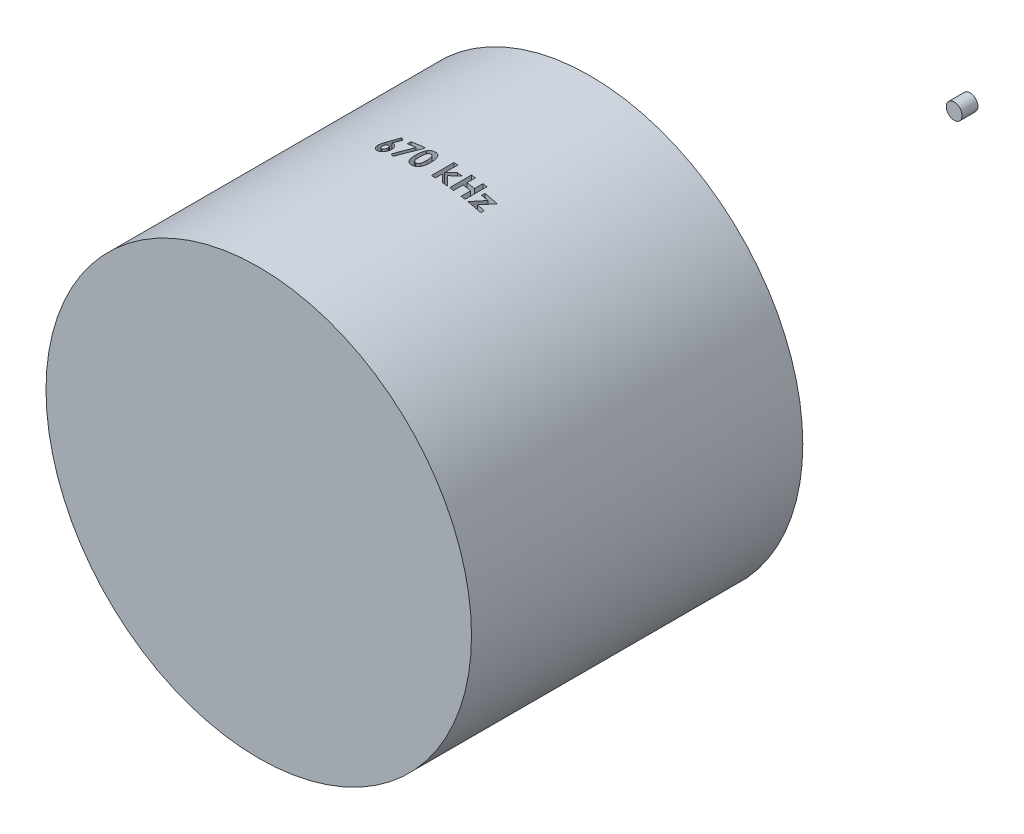
from build123d import *

# Parameters (mm, degrees)
SKETCH2_W          = 52.999999918
SKETCH2_H          = 34.036
SKETCH2_W_2        = 2.54
SKETCH2_H_2        = 1.27
CUT_EXTRUDE1_START = 50.8
CUT_EXTRUDE1_DEPTH = 22.86


with BuildPart() as part:
    # Sketch2 → Revolve1 (revolve)
    with BuildSketch(Plane(origin=(0, 0, 0), x_dir=(0, 0, -1), z_dir=(1, 0, 0)), mode=Mode.PRIVATE) as revolve1_sk:
        with Locations((26.499999959, 17.018)):
            Rectangle(SKETCH2_W, SKETCH2_H)
        with Locations((112.525999992, 0.635)):
            Rectangle(SKETCH2_W_2, SKETCH2_H_2)
    revolve(revolve1_sk.sketch.rotate(Axis((0, 0, 0), (0, 0, -1)), 90), axis=Axis((0, 0, 0), (0, 0, -1)))

    # Sketch3 → Cut-Extrude1 (cut)
    # profile 1 of 6: a face of its own
    with BuildSketch(Plane(origin=(0, 0, 0), x_dir=(1, 0, 0), z_dir=(0, 1, 0)).offset(CUT_EXTRUDE1_START)):
        with BuildLine():
            Line((-7.23838141, 30.089743549), (-6.682391827, 29.807892587))
            Line((-6.682391827, 29.807892587), (-7.292367788, 28.608974318))
            add(Edge.make_bspline(
                [(-7.292367788, 28.608974318), (-7.256330981, 28.608041307), (-7.185350579, 28.606203588), (-7.08091732, 28.591350841), (-6.98107718, 28.565674002), (-6.884823476, 28.531639422), (-6.793332818, 28.485930642), (-6.705131698, 28.431557664), (-6.622501924, 28.365243969), (-6.543548865, 28.291771913), (-6.471757254, 28.210375434), (-6.409393548, 28.122912332), (-6.355044679, 28.031510595), (-6.312796055, 27.934125343), (-6.278716909, 27.832370849), (-6.254127305, 27.725840355), (-6.240098248, 27.614225374), (-6.238164108, 27.538400261), (-6.237179487, 27.499799638)],
                knots=[0, 0, 0, 0, 1.013260694, 1.995783107, 2.958651975, 3.908806537, 4.861209129, 5.829647963, 6.817170299, 7.835534541, 8.860094905, 9.863329007, 10.853101798, 11.844815043, 12.84250023, 13.867713965, 14.914507806, 16, 16, 16, 16], degree=3))
            add(Edge.make_bspline(
                [(-6.237179487, 27.499799638), (-6.238102158, 27.46259098), (-6.239925884, 27.389045418), (-6.255001389, 27.281025691), (-6.279364196, 27.177387081), (-6.314183541, 27.078336566), (-6.358441744, 26.983389984), (-6.412566528, 26.892603051), (-6.477006754, 26.806654188), (-6.550097463, 26.726000086), (-6.629998218, 26.652483276), (-6.714217965, 26.587137256), (-6.803470373, 26.533158965), (-6.896068466, 26.487573032), (-6.993717032, 26.453556051), (-7.094954755, 26.427879124), (-7.20054935, 26.413062422), (-7.272224256, 26.411199205), (-7.30849359, 26.410256369)],
                knots=[0, 0, 0, 0, 1.049934834, 2.075270938, 3.072134561, 4.05064612, 5.033440221, 6.024524368, 7.028587226, 8.060776465, 9.092543989, 10.090062252, 11.064205434, 12.031961459, 12.998029633, 13.977230324, 14.976426867, 16, 16, 16, 16], degree=3))
            add(Edge.make_bspline(
                [(-7.30849359, 26.410256369), (-7.346420291, 26.411030104), (-7.420998017, 26.412551549), (-7.530123894, 26.429587726), (-7.634785003, 26.455233315), (-7.73439313, 26.491850859), (-7.829567709, 26.538476355), (-7.919188231, 26.596170717), (-8.004009624, 26.66429773), (-8.083127569, 26.741324644), (-8.154406941, 26.82569709), (-8.217982184, 26.913297656), (-8.271766921, 27.004263807), (-8.315304412, 27.098498281), (-8.349273373, 27.195700798), (-8.372908841, 27.296055839), (-8.388309529, 27.399297213), (-8.390114909, 27.469362652), (-8.391025641, 27.504707491)],
                knots=[0, 0, 0, 0, 1.063775006, 2.091769615, 3.092589432, 4.084662827, 5.064601646, 6.061867366, 7.070035304, 8.113879863, 9.156342271, 10.166834137, 11.149076039, 12.117706134, 13.076241869, 14.034148791, 15.008317125, 16, 16, 16, 16], degree=3))
            add(Edge.make_bspline(
                [(-8.391025641, 27.504707491), (-8.390544428, 27.532077935), (-8.389579323, 27.586971177), (-8.3798806, 27.669170824), (-8.365135132, 27.751586237), (-8.348043205, 27.821130973), (-8.330443666, 27.879938325), (-8.312729594, 27.929705398), (-8.290776905, 27.984935966), (-8.265681729, 28.045771068), (-8.236654916, 28.112137517), (-8.203848094, 28.183854417), (-8.167179592, 28.261464861), (-8.141029899, 28.314771219), (-8.127403846, 28.342548036)],
                knots=[0, 0, 0, 0, 1.110454016, 2.227089276, 3.35462975, 4.507227546, 5.131400587, 5.845402449, 6.650387134, 7.543487832, 8.516250726, 9.590168902, 10.744287919, 12, 12, 12, 12], degree=3))
            Line((-8.127403846, 28.342548036), (-7.23838141, 30.089743549))
        make_face()
        with BuildLine():
            add(Edge.make_bspline(
                [(-7.322516026, 28.025640985), (-7.35265922, 28.02425838), (-7.411645494, 28.021552804), (-7.495515154, 27.993218698), (-7.571985255, 27.948769537), (-7.638270484, 27.886865484), (-7.69371198, 27.81288771), (-7.734452336, 27.728506177), (-7.758959924, 27.634846934), (-7.761506106, 27.569361953), (-7.762820513, 27.53555685)],
                knots=[0, 0, 0, 0, 0.981744412, 1.921144944, 2.858899012, 3.85339082, 4.86292663, 5.863643845, 6.897155691, 8, 8, 8, 8], degree=3))
            add(Edge.make_bspline(
                [(-7.762820513, 27.53555685), (-7.761264214, 27.50174049), (-7.758237108, 27.43596541), (-7.732808002, 27.341414364), (-7.691172666, 27.255116624), (-7.632781761, 27.180158484), (-7.564231679, 27.117937424), (-7.488217768, 27.071921975), (-7.406007968, 27.043653175), (-7.349141442, 27.040204006), (-7.32041266, 27.038461497)],
                knots=[0, 0, 0, 0, 1.098279937, 2.136227893, 3.159405121, 4.194678092, 5.206500211, 6.154139736, 7.067477469, 8, 8, 8, 8], degree=3))
            add(Edge.make_bspline(
                [(-7.32041266, 27.038461497), (-7.290071819, 27.040235041), (-7.230568161, 27.043713269), (-7.144730231, 27.07079257), (-7.066316767, 27.116037109), (-6.996984097, 27.178058963), (-6.937428652, 27.25216173), (-6.896222299, 27.338966371), (-6.869617594, 27.434199853), (-6.866827244, 27.501013683), (-6.865384615, 27.53555685)],
                knots=[0, 0, 0, 0, 0.96921794, 1.900804717, 2.848419905, 3.844199796, 4.861108892, 5.867439427, 6.897452859, 8, 8, 8, 8], degree=3))
            add(Edge.make_bspline(
                [(-6.865384615, 27.53555685), (-6.867028033, 27.569342214), (-6.870210702, 27.634771517), (-6.894116323, 27.728869532), (-6.936798194, 27.812925827), (-6.993494098, 27.887170853), (-7.062060514, 27.949047302), (-7.141591104, 27.993569238), (-7.22929207, 28.021502605), (-7.290988303, 28.024241412), (-7.322516026, 28.025640985)],
                knots=[0, 0, 0, 0, 1.083229974, 2.097801324, 3.086792542, 4.086858909, 5.079819718, 6.026392613, 6.991456328, 8, 8, 8, 8], degree=3))
        make_face(mode=Mode.SUBTRACT)
    # profile 2 of 6: a face of its own
    with BuildSketch(Plane(origin=(0, 0, 0), x_dir=(1, 0, 0), z_dir=(0, 1, 0)).offset(CUT_EXTRUDE1_START)):
        Polygon((-5.653846154, 29.999999959), (-3.41025641, 29.999999959), (-3.41025641, 29.673978324), (-4.954126603, 26.410256369), (-5.510817308, 26.690705087), (-4.220753205, 29.416666626), (-5.653846154, 29.416666626), align=None)
    # profile 3 of 6: a face of its own
    with BuildSketch(Plane(origin=(0, 0, 0), x_dir=(1, 0, 0), z_dir=(0, 1, 0)).offset(CUT_EXTRUDE1_START)):
        with BuildLine():
            add(Edge.make_bspline(
                [(-1.917568109, 30.089743549), (-1.887160373, 30.089292137), (-1.827370641, 30.088404542), (-1.739311619, 30.07879116), (-1.654486435, 30.064268022), (-1.572563241, 30.044013308), (-1.494131729, 30.017206916), (-1.418621058, 29.985120124), (-1.346930023, 29.946069915), (-1.278144335, 29.901960697), (-1.21229049, 29.85202281), (-1.15095124, 29.795091039), (-1.093006398, 29.732475389), (-1.039710259, 29.663229222), (-0.989882561, 29.587982406), (-0.943687031, 29.506723009), (-0.901477308, 29.41905332), (-0.86278032, 29.324815133), (-0.828177351, 29.222595858), (-0.799031313, 29.111222996), (-0.774033709, 28.990671112), (-0.752933967, 28.860640135), (-0.736985972, 28.720957223), (-0.726236703, 28.571715173), (-0.718860045, 28.413201703), (-0.718258014, 28.304462765), (-0.717948718, 28.248597715)],
                knots=[0, 0, 0, 0, 0.879237366, 1.728815576, 2.559023295, 3.367336655, 4.166867292, 4.954216142, 5.737608147, 6.525189134, 7.316157332, 8.124696809, 8.942788509, 9.781158001, 10.649253743, 11.551476218, 12.482711956, 13.461909668, 14.496590415, 15.601789533, 16.789733467, 18.056700938, 19.410929216, 20.8549011, 22.384193279, 24, 24, 24, 24], degree=3))
            add(Edge.make_bspline(
                [(-0.717948718, 28.248597715), (-0.718282983, 28.192033731), (-0.718932455, 28.082130924), (-0.725930053, 27.922167609), (-0.737980247, 27.771841973), (-0.753511408, 27.631169567), (-0.774784849, 27.500224678), (-0.799699006, 27.378668248), (-0.829305105, 27.266544337), (-0.865047885, 27.164105584), (-0.903510639, 27.069701894), (-0.945835825, 26.98220314), (-0.991285719, 26.901372328), (-1.038817839, 26.825990014), (-1.091038071, 26.75827843), (-1.145404707, 26.69593503), (-1.20428497, 26.641334552), (-1.265199772, 26.591663134), (-1.330380668, 26.548737061), (-1.399155466, 26.511194625), (-1.4727503, 26.48074325), (-1.549823662, 26.454258271), (-1.631689283, 26.435244914), (-1.717046329, 26.420158439), (-1.806858464, 26.411820728), (-1.868006184, 26.41078638), (-1.899338942, 26.410256369)],
                knots=[0, 0, 0, 0, 1.643780988, 3.193836972, 4.651895693, 6.025988579, 7.305620092, 8.505800249, 9.631074763, 10.672816429, 11.65661981, 12.592235626, 13.49536222, 14.350718032, 15.179365177, 15.97804903, 16.751647189, 17.51006938, 18.259804725, 19.016521909, 19.783502495, 20.571750527, 21.382245291, 22.22305063, 23.089471752, 24, 24, 24, 24], degree=3))
            add(Edge.make_bspline(
                [(-1.899338942, 26.410256369), (-1.930670855, 26.410796604), (-1.992049612, 26.411854916), (-2.082104608, 26.420096445), (-2.167914004, 26.435306029), (-2.250427314, 26.454404241), (-2.329070257, 26.480684649), (-2.404219925, 26.512047107), (-2.475298482, 26.549355297), (-2.542502733, 26.592381384), (-2.605603224, 26.641720463), (-2.665580535, 26.696844797), (-2.722301994, 26.75761466), (-2.774904727, 26.824710724), (-2.824250214, 26.897237398), (-2.869823859, 26.9760229), (-2.911598275, 27.06095252), (-2.950880172, 27.152144643), (-2.985011168, 27.251562529), (-3.01538617, 27.360093968), (-3.040268572, 27.478643659), (-3.060280665, 27.607173516), (-3.076258309, 27.745411244), (-3.088143839, 27.893423565), (-3.095180306, 28.051279421), (-3.095822966, 28.159781614), (-3.096153846, 28.215644991)],
                knots=[0, 0, 0, 0, 0.917216111, 1.796812873, 2.643793957, 3.46689424, 4.273913431, 5.068098542, 5.848489301, 6.620921603, 7.401012384, 8.190319798, 9.003608147, 9.831726257, 10.68377682, 11.569763213, 12.493818149, 13.453288342, 14.474581811, 15.568529029, 16.750744269, 18.018426408, 19.375425659, 20.823733699, 22.36466933, 24, 24, 24, 24], degree=3))
            add(Edge.make_bspline(
                [(-3.096153846, 28.215644991), (-3.095554488, 28.293262756), (-3.09439802, 28.443027234), (-3.079742399, 28.659393361), (-3.058231666, 28.859386365), (-3.026637494, 29.042671708), (-2.987571737, 29.209928224), (-2.937546001, 29.360054115), (-2.880595339, 29.495126711), (-2.83206606, 29.57514453), (-2.80869391, 29.61368185)],
                knots=[0, 0, 0, 0, 1.288568992, 2.486310467, 3.599230591, 4.627010532, 5.572937695, 6.447898582, 7.252493626, 8, 8, 8, 8], degree=3))
            add(Edge.make_bspline(
                [(-2.80869391, 29.61368185), (-2.781517888, 29.651540901), (-2.72838341, 29.725562807), (-2.635476291, 29.822739733), (-2.535659687, 29.905850198), (-2.426883423, 29.973013339), (-2.31086784, 30.025978197), (-2.186616887, 30.06338668), (-2.0545894, 30.085182606), (-1.963923923, 30.088200531), (-1.917568109, 30.089743549)],
                knots=[0, 0, 0, 0, 1.058512271, 2.069600068, 3.047294572, 4.004278952, 4.967380941, 5.939006123, 6.946246673, 8, 8, 8, 8], degree=3))
        make_face()
        with BuildLine():
            add(Edge.make_bspline(
                [(-1.902143429, 29.461538421), (-1.929632275, 29.460235504), (-1.983525003, 29.457681096), (-2.06172592, 29.435997774), (-2.135464501, 29.402506715), (-2.191555471, 29.362205462), (-2.233539004, 29.323571877), (-2.2628732, 29.28860974), (-2.291161408, 29.249594514), (-2.316146978, 29.204765644), (-2.339739878, 29.155733883), (-2.362797253, 29.102276657), (-2.381698246, 29.04308094), (-2.40026797, 28.979154844), (-2.416536782, 28.908730981), (-2.430166479, 28.831233715), (-2.442343416, 28.746159073), (-2.450836974, 28.653451331), (-2.458755519, 28.553207485), (-2.464431908, 28.44520423), (-2.466805063, 28.329470703), (-2.467559417, 28.24976674), (-2.467948718, 28.208633773)],
                knots=[0, 0, 0, 0, 1.076674018, 2.110852608, 3.161083442, 4.239746716, 4.804137807, 5.395870207, 6.026861976, 6.692161227, 7.405688833, 8.16177676, 8.973626916, 9.841385931, 10.773283133, 11.807421078, 12.927755683, 14.143907515, 15.458935494, 16.872852025, 18.386167141, 20, 20, 20, 20], degree=3))
            add(Edge.make_bspline(
                [(-2.467948718, 28.208633773), (-2.467307976, 28.155344026), (-2.466079306, 28.053156985), (-2.459644107, 27.906208462), (-2.446745284, 27.772473474), (-2.430701753, 27.651045648), (-2.408167959, 27.542712477), (-2.38224137, 27.446449029), (-2.350224338, 27.363482429), (-2.313222488, 27.292612793), (-2.272241272, 27.23232414), (-2.227754359, 27.181078514), (-2.181276369, 27.13670222), (-2.131356574, 27.100655903), (-2.078114066, 27.073031667), (-2.021993323, 27.053161895), (-1.962958681, 27.040998781), (-1.922532367, 27.039312148), (-1.902143429, 27.038461497)],
                knots=[0, 0, 0, 0, 1.771748488, 3.397459088, 4.888034009, 6.237357457, 7.467047327, 8.564189669, 9.548206622, 10.417051504, 11.216568818, 11.965764335, 12.669334354, 13.348544111, 14.005342236, 14.656555988, 15.322436492, 16, 16, 16, 16], degree=3))
            add(Edge.make_bspline(
                [(-1.902143429, 27.038461497), (-1.882454176, 27.039043576), (-1.843905066, 27.040183212), (-1.787691831, 27.051881428), (-1.734532601, 27.070900186), (-1.684587881, 27.097803554), (-1.637679026, 27.132015303), (-1.594035297, 27.173685774), (-1.553985846, 27.223230325), (-1.530652855, 27.259999708), (-1.518629808, 27.278946273)],
                knots=[0, 0, 0, 0, 0.992283464, 1.942767638, 2.88273346, 3.832339453, 4.79467288, 5.803907806, 6.868395428, 8, 8, 8, 8], degree=3))
            add(Edge.make_bspline(
                [(-1.518629808, 27.278946273), (-1.504474695, 27.304836148), (-1.47479257, 27.359125117), (-1.440444365, 27.450735726), (-1.41153196, 27.554057353), (-1.386647476, 27.669411544), (-1.369628007, 27.797253269), (-1.35497086, 27.936771874), (-1.347901355, 28.088669917), (-1.346751461, 28.193905429), (-1.346153846, 28.248597715)],
                knots=[0, 0, 0, 0, 0.710965849, 1.490837728, 2.352621235, 3.297892224, 4.334225155, 5.461620853, 6.680770821, 8, 8, 8, 8], degree=3))
            add(Edge.make_bspline(
                [(-1.346153846, 28.248597715), (-1.346384692, 28.303764757), (-1.34682903, 28.409951894), (-1.354981357, 28.562396022), (-1.366334096, 28.701628432), (-1.382939874, 28.827338275), (-1.404306227, 28.93983072), (-1.430640337, 29.039098413), (-1.461686293, 29.125336992), (-1.498503098, 29.198460464), (-1.539279997, 29.260605385), (-1.58256592, 29.313920906), (-1.628543897, 29.359440353), (-1.677137039, 29.397335023), (-1.729470051, 29.426289394), (-1.784543304, 29.446733575), (-1.842469701, 29.459101618), (-1.881983705, 29.46071519), (-1.902143429, 29.461538421)],
                knots=[0, 0, 0, 0, 1.793836731, 3.452829483, 4.963243077, 6.335886805, 7.574563692, 8.684454726, 9.672768357, 10.54971625, 11.340229787, 12.085688095, 12.778991901, 13.440269426, 14.083255152, 14.715733572, 15.344777694, 16, 16, 16, 16], degree=3))
        make_face(mode=Mode.SUBTRACT)
    # profile 4 of 6: a face of its own
    with BuildSketch(Plane(origin=(0, 0, 0), x_dir=(1, 0, 0), z_dir=(0, 1, 0)).offset(CUT_EXTRUDE1_START)):
        Polygon((1.121794872, 30.089743549), (1.75, 30.089743549), (1.75, 27.996193869), (2.727363782, 29.057692267), (3.503505609, 29.057692267), (2.381009615, 27.838441465), (3.6640625, 26.499999959), (2.873197115, 26.499999959), (1.75, 27.671574478), (1.75, 26.499999959), (1.121794872, 26.499999959), align=None)
    # profile 5 of 6: a face of its own
    with BuildSketch(Plane(origin=(0, 0, 0), x_dir=(1, 0, 0), z_dir=(0, 1, 0)).offset(CUT_EXTRUDE1_START)):
        Polygon((4.038461538, 29.999999959), (4.666666667, 29.999999959), (4.666666667, 28.653846113), (5.878205128, 28.653846113), (5.878205128, 29.999999959), (6.506410256, 29.999999959), (6.506410256, 26.499999959), (5.878205128, 26.499999959), (5.878205128, 28.025640985), (4.666666667, 28.025640985), (4.666666667, 26.499999959), (4.038461538, 26.499999959), align=None)
    # profile 6 of 6: a face of its own
    with BuildSketch(Plane(origin=(0, 0, 0), x_dir=(1, 0, 0), z_dir=(0, 1, 0)).offset(CUT_EXTRUDE1_START)):
        Polygon((7.134615385, 29.057692267), (9.108974359, 29.057692267), (7.932491987, 27.038461497), (9.019230769, 27.038461497), (9.019230769, 26.499999959), (6.955128205, 26.499999959), (8.131610577, 28.519230728), (7.134615385, 28.519230728), align=None)
    extrude(amount=-CUT_EXTRUDE1_DEPTH, mode=Mode.SUBTRACT)


solid = part.part
